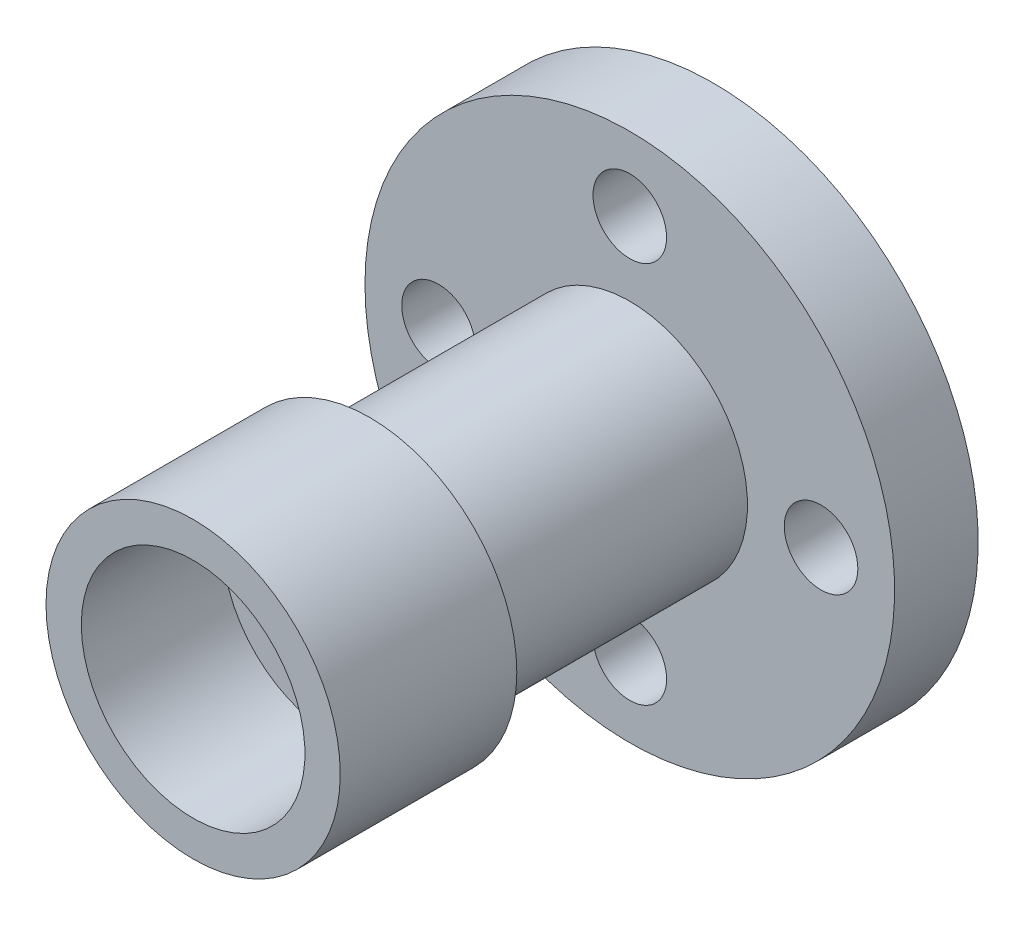
from build123d import *

# Parameters (mm, degrees)
CROQUIS4_R            = 6.25
CORTAR_EXTRUIR2_DEPTH = 109.92456105


with BuildPart() as part:
    # Croquis2 → Revolución2 (revolve)
    with BuildSketch(Plane(origin=(0, 0, 0), x_dir=(0, 0, -1), z_dir=(1, 0, 0)), mode=Mode.PRIVATE) as revoluci_n2_sk:
        Polygon((0, 18.5), (0, 45), (-14.2, 45), (-14.2, 20), (-58.4, 20), (-58.4, 25), (-88.4, 25), (-88.4, 19), (-64.4, 19), (-64.4, 15), (-3, 15), align=None)
    revolve(revoluci_n2_sk.sketch.rotate(Axis((0, 0, 0), (0, 0, 1)), 90), axis=Axis((0, 0, 0), (0, 0, 1)))

    # Croquis4 → Cortar-Extruir2 (cut, through all)
    with BuildSketch(Plane(origin=(0, 0, 0), x_dir=(-1, 0, 0), z_dir=(0, 0, -1))):
        with Locations((0, 32.5)):
            Circle(CROQUIS4_R)
        with Locations((32.5, 0)):
            Circle(CROQUIS4_R)
        with Locations((0, -32.5)):
            Circle(CROQUIS4_R)
        with Locations((-32.5, 0)):
            Circle(CROQUIS4_R)
    extrude(amount=-CORTAR_EXTRUIR2_DEPTH, mode=Mode.SUBTRACT)


solid = part.part
